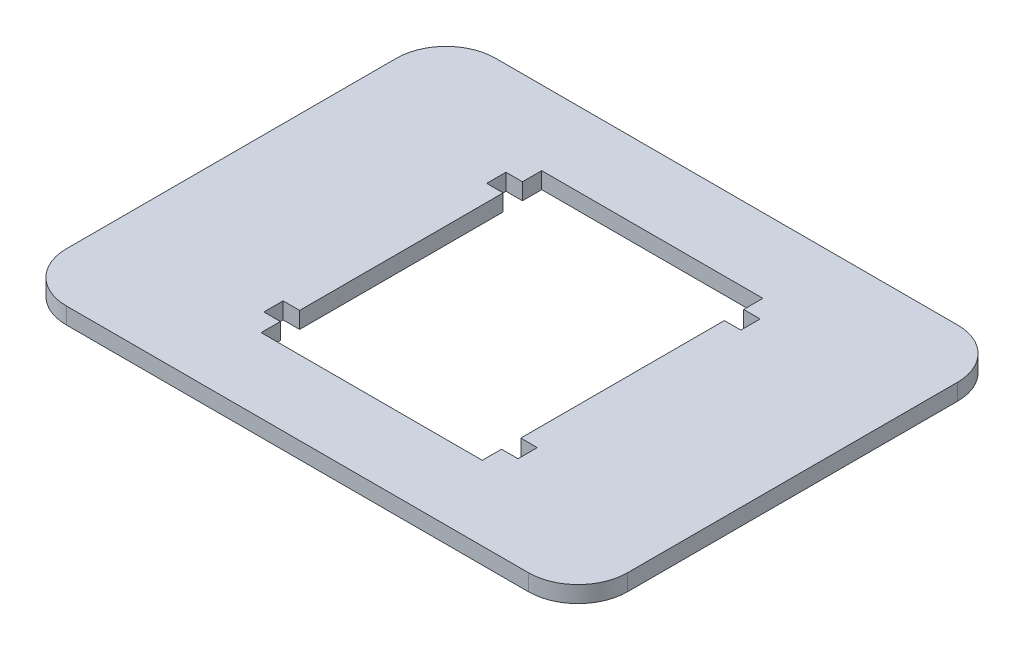
from build123d import *

# Parameters (mm, degrees)
SKETCH1_W           = 170
SKETCH1_H           = 130
BOSS_EXTRUDE1_DEPTH = 5
SKETCH2_W           = 67
SKETCH2_H           = 85
CUT_EXTRUDE1_DEPTH  = 108.121426428
SKETCH3_W           = 5
SKETCH3_H           = 5.833333
CUT_EXTRUDE2_DEPTH  = 108.121426428
FILLET1_R           = 15


with BuildPart() as part:
    # Sketch1 → Boss-Extrude1 (new body)
    with BuildSketch(Plane(origin=(0, 0, 0), x_dir=(1, 0, 0), z_dir=(0, 1, 0))):
        Rectangle(SKETCH1_W, SKETCH1_H)
    extrude(amount=BOSS_EXTRUDE1_DEPTH)

    # Sketch2 → Cut-Extrude1 (cut, through all)
    with BuildSketch(Plane(origin=(0, 5, 0), x_dir=(1, 0, 0), z_dir=(0, 1, 0))):
        Rectangle(SKETCH2_W, SKETCH2_H)
    extrude(amount=-CUT_EXTRUDE1_DEPTH, mode=Mode.SUBTRACT)

    # Sketch3 → Cut-Extrude2 (cut, through all)
    with BuildSketch(Plane(origin=(0, 5, 0), x_dir=(1, 0, 0), z_dir=(0, 1, 0))):
        with Locations((36, -33.7500005)):
            Rectangle(SKETCH3_W, SKETCH3_H)
        with Locations((36, 33.7500005)):
            Rectangle(SKETCH3_W, SKETCH3_H)
        with Locations((-36, 33.7500005)):
            Rectangle(SKETCH3_W, SKETCH3_H)
        with Locations((-36, -33.7500005)):
            Rectangle(SKETCH3_W, SKETCH3_H)
    extrude(amount=-CUT_EXTRUDE2_DEPTH, mode=Mode.SUBTRACT)

    # Fillet1
    fillet1_edges = [part.edges().sort_by_distance(p)[0] for p in [
        (85, 2.5, -65),
        (85, 2.5, 65),
        (-85, 2.5, 65),
        (-85, 2.5, -65),
    ]]
    fillet(fillet1_edges, radius=FILLET1_R)


solid = part.part
